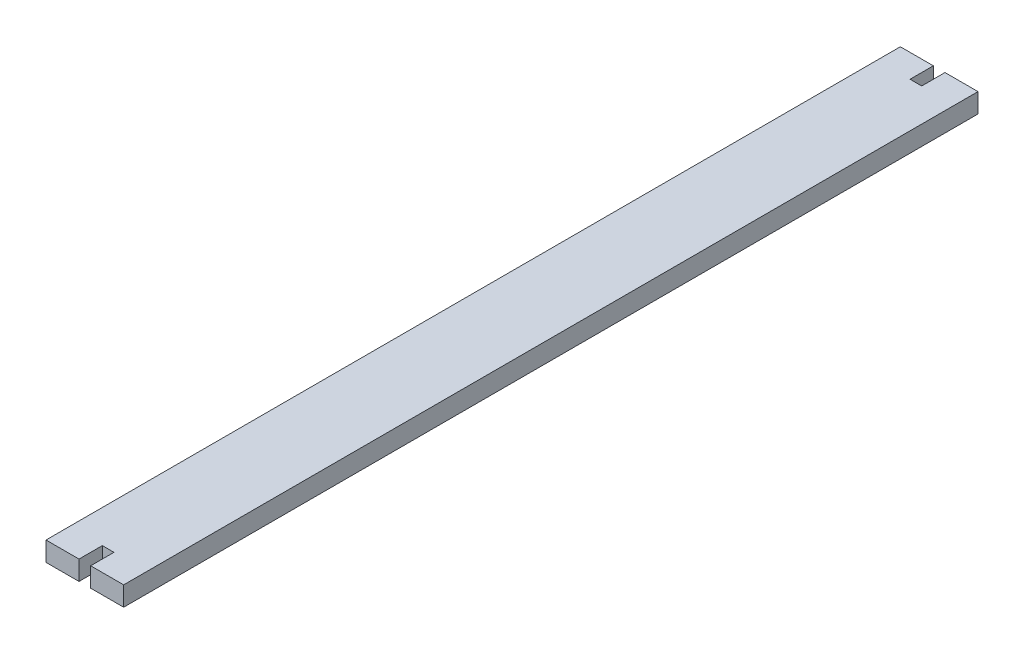
from build123d import *

# Parameters (mm, degrees)
SKETCH1_W           = 20
SKETCH1_H           = 220
BOSS_EXTRUDE1_DEPTH = 5
SKETCH2_W           = 3
SKETCH2_H           = 6
CUT_EXTRUDE1_DEPTH  = 111.566721937


with BuildPart() as part:
    # Sketch1 → Boss-Extrude1 (new body)
    with BuildSketch(Plane(origin=(0, 0, 0), x_dir=(1, 0, 0), z_dir=(0, 1, 0))):
        Rectangle(SKETCH1_W, SKETCH1_H)
    extrude(amount=-BOSS_EXTRUDE1_DEPTH)

    # Sketch2 → Cut-Extrude1 (cut, through all)
    with BuildSketch(Plane(origin=(0, 0, 0), x_dir=(1, 0, 0), z_dir=(0, 1, 0))):
        with Locations((0, -107)):
            Rectangle(SKETCH2_W, SKETCH2_H)
        with Locations((0, 107)):
            Rectangle(SKETCH2_W, SKETCH2_H)
    extrude(amount=-CUT_EXTRUDE1_DEPTH, mode=Mode.SUBTRACT)


solid = part.part
